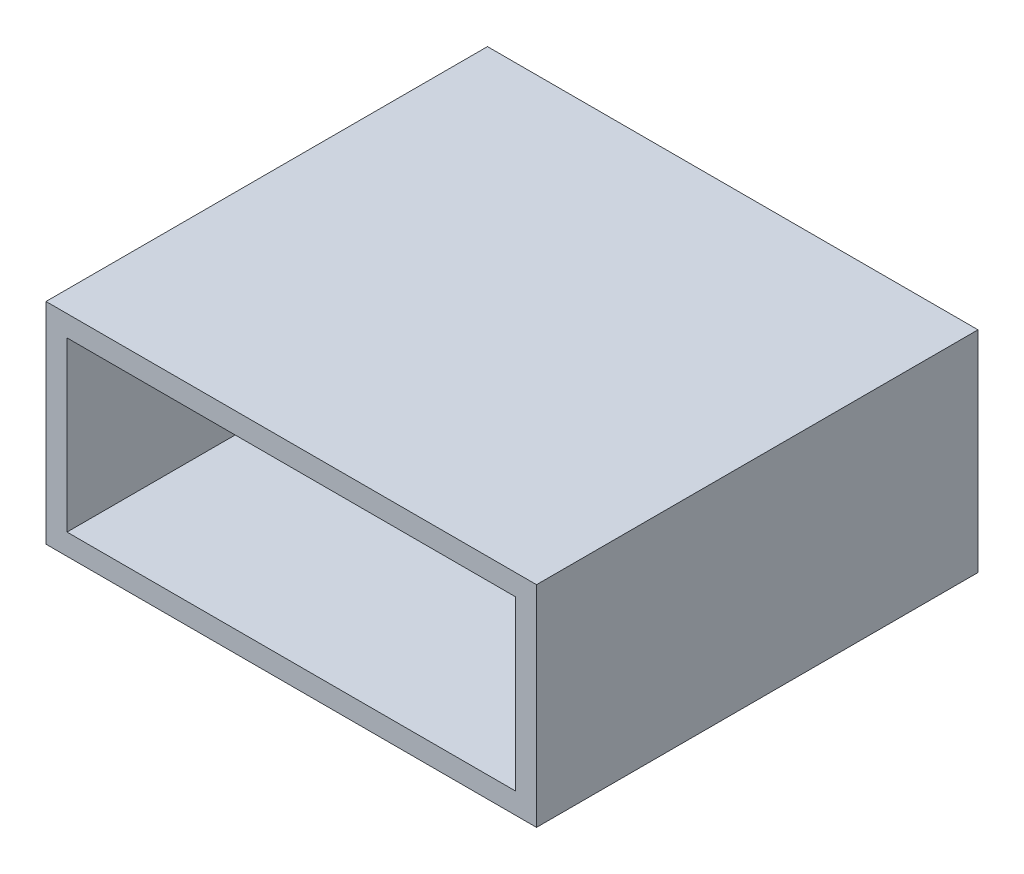
from build123d import *

# Parameters (mm, degrees)
SKETCH1_W           = 70
SKETCH1_H           = 30
SKETCH1_W_2         = 64
SKETCH1_H_2         = 24
BOSS_EXTRUDE1_DEPTH = 60
SKETCH2_W           = 70
SKETCH2_H           = 30
BOSS_EXTRUDE2_DEPTH = 3


with BuildPart() as part:
    # Sketch1 → Boss-Extrude1 (new body)
    with BuildSketch(Plane.XY):
        Rectangle(SKETCH1_W, SKETCH1_H)
        Rectangle(SKETCH1_W_2, SKETCH1_H_2, mode=Mode.SUBTRACT)
    extrude(amount=BOSS_EXTRUDE1_DEPTH)

    # Sketch2 → Boss-Extrude2 (add)
    with BuildSketch(Plane(origin=(0, 0, 0), x_dir=(-1, 0, 0), z_dir=(0, 0, -1))):
        Rectangle(SKETCH2_W, SKETCH2_H)
    extrude(amount=BOSS_EXTRUDE2_DEPTH)


solid = part.part
